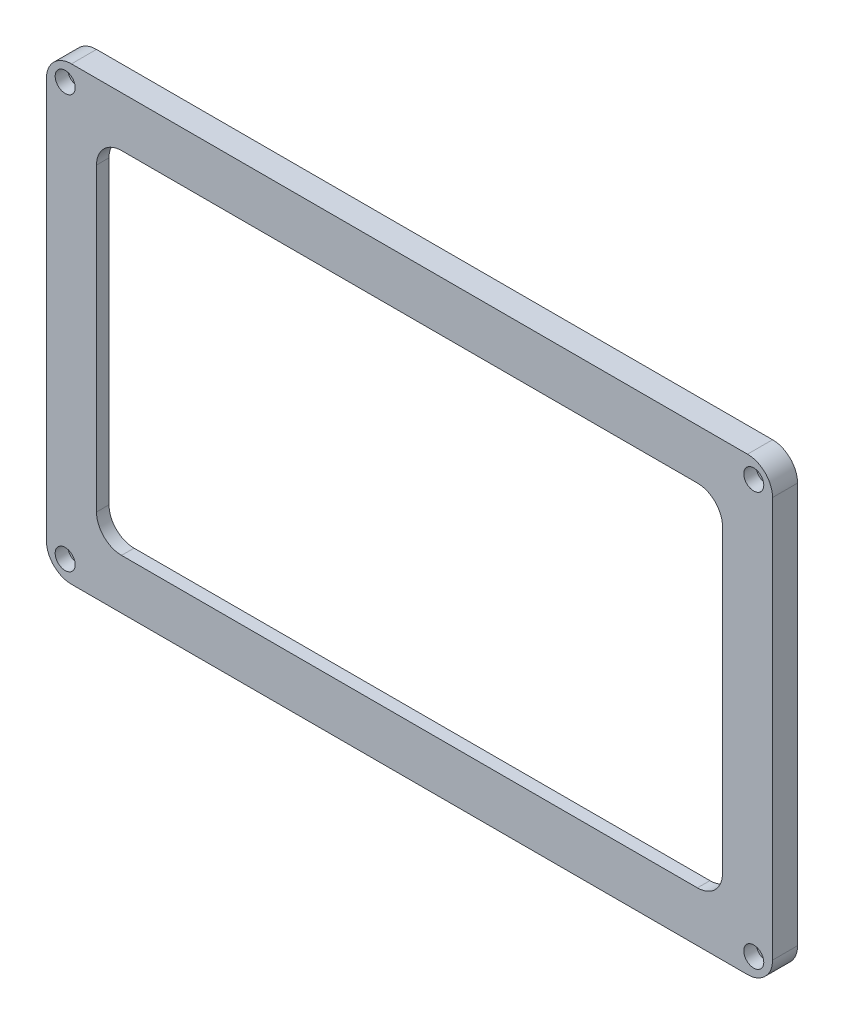
from build123d import *

# Parameters (mm, degrees)
SKETCH_1_W          = 58
SKETCH_1_H          = 36
EXTRUDE_1_DEPTH     = 3
SKETCH_2_W          = 52.5
SKETCH_2_H          = 30.5
CUT_EXTRUDE_1_DEPTH = 2
SKETCH_3_W          = 50
SKETCH_3_H          = 28
CUT_EXTRUDE_2_DEPTH = 2
FILLET_1_R          = 2
SKETCH_4_W          = 58
SKETCH_4_H          = 36
CUT_EXTRUDE_3_DEPTH = 1
FILLET_2_R          = 0.2
SKETCH_5_R          = 0.8
CUT_EXTRUDE_4_DEPTH = 1
SKETCH_6_R          = 0.6
CUT_EXTRUDE_5_DEPTH = 20.5


with BuildPart() as part:
    # 草图1 → 凸台-拉伸1 (new body)
    with BuildSketch(Plane.XY):
        Rectangle(SKETCH_1_W, SKETCH_1_H)
    extrude(amount=EXTRUDE_1_DEPTH)

    # 草图2 → 切除-拉伸1 (cut)
    with BuildSketch(Plane(origin=(0, 0, 0), x_dir=(-1, 0, 0), z_dir=(0, 0, -1))):
        Rectangle(SKETCH_2_W, SKETCH_2_H)
    extrude(amount=-CUT_EXTRUDE_1_DEPTH, mode=Mode.SUBTRACT)

    # 草图3 → 切除-拉伸2 (cut)
    with BuildSketch(Plane.XY.offset(3)):
        Rectangle(SKETCH_3_W, SKETCH_3_H)
    extrude(amount=-CUT_EXTRUDE_2_DEPTH, mode=Mode.SUBTRACT)

    # 圆角1
    fillet_1_edges = [part.edges().sort_by_distance(p)[0] for p in [
        (25, 14, 2.5),
        (25, -14, 2.5),
        (-25, -14, 2.5),
        (-25, 14, 2.5),
        (29, -18, 1.5),
        (-29, -18, 1.5),
        (-29, 18, 1.5),
        (29, 18, 1.5),
    ]]
    fillet(fillet_1_edges, radius=FILLET_1_R)

    # 草图4 → 切除-拉伸3 (cut)
    with BuildSketch(Plane(origin=(0, 0, 0), x_dir=(-1, 0, 0), z_dir=(0, 0, -1))):
        Rectangle(SKETCH_4_W, SKETCH_4_H)
    extrude(amount=-CUT_EXTRUDE_3_DEPTH, mode=Mode.SUBTRACT)

    # 圆角2
    fillet_2_edges = [part.edges().sort_by_distance(p)[0] for p in [
        (-26.25, 15.25, 1.5),
        (-26.25, -15.25, 1.5),
        (26.25, -15.25, 1.5),
        (26.25, 15.25, 1.5),
    ]]
    fillet(fillet_2_edges, radius=FILLET_2_R)

    # 草图5 → 切除-拉伸4 (cut)
    with BuildSketch(Plane.XY.offset(3)):
        with Locations((-27.5, 16.5)):
            Circle(SKETCH_5_R)
        with Locations((27.5, 16.5)):
            Circle(SKETCH_5_R)
        with Locations((27.5, -16.5)):
            Circle(SKETCH_5_R)
        with Locations((-27.5, -16.5)):
            Circle(SKETCH_5_R)
    extrude(amount=-CUT_EXTRUDE_4_DEPTH, mode=Mode.SUBTRACT)

    # 草图6 → 切除-拉伸5 (cut)
    with BuildSketch(Plane.XY.offset(2)):
        with Locations((-27.5, 16.5)):
            Circle(SKETCH_6_R)
        with Locations((27.5, 16.5)):
            Circle(SKETCH_6_R)
        with Locations((27.5, -16.5)):
            Circle(SKETCH_6_R)
        with Locations((-27.5, -16.5)):
            Circle(SKETCH_6_R)
    extrude(amount=-CUT_EXTRUDE_5_DEPTH, mode=Mode.SUBTRACT)


solid = part.part
